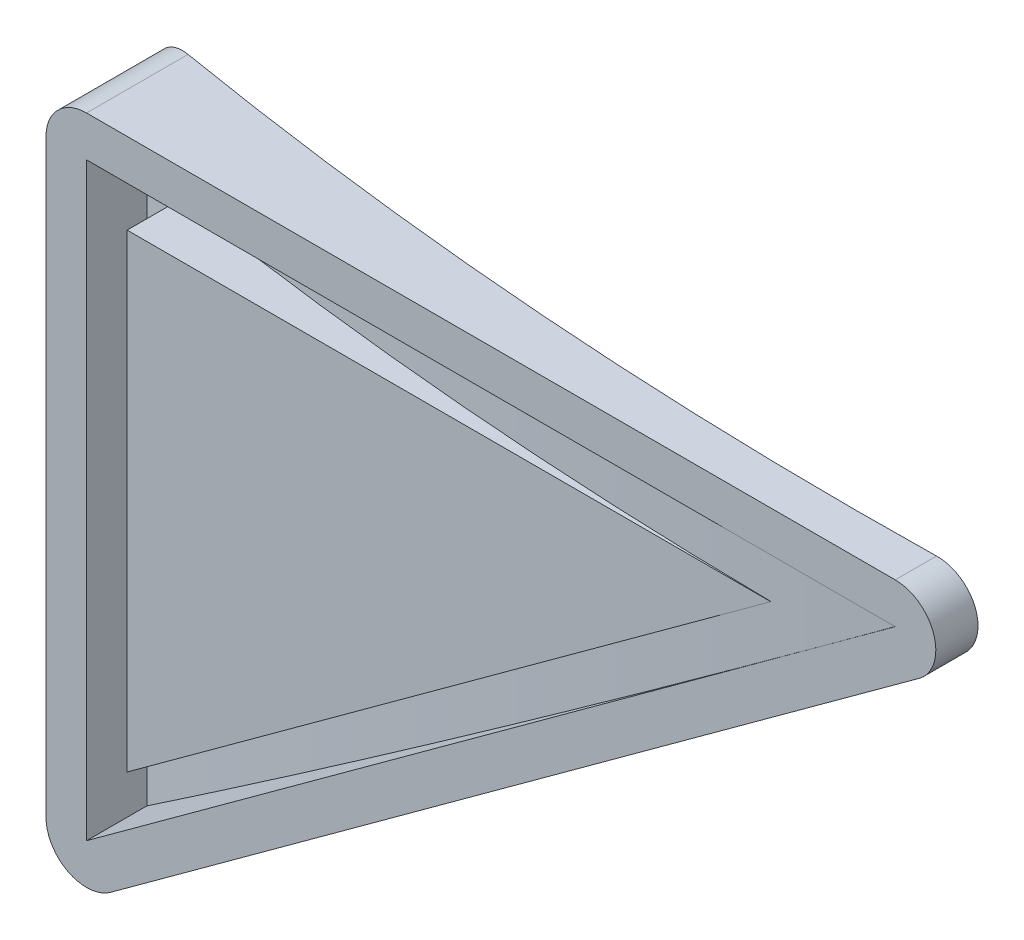
from build123d import *

# Parameters (mm, degrees)
BOSS_EXTRUDE1_DEPTH      = 175
FILLET1_R                = 10
CUT_EXTRUDE3_DEPTH       = 1129.731146152
CUT_EXTRUDE3_DEPTH_BACK  = 1129.731146152
SKETCH4_OUTSIDE_W        = 489.508
SKETCH4_OUTSIDE_H        = 264.508
FILLET4_R                = 10
BOSS_EXTRUDE2_REACH      = 261.692
BOSS_EXTRUDE2_END_RADIUS = 1097
BOSS_EXTRUDE3_REACH      = 261.692
BOSS_EXTRUDE3_END_RADIUS = 1097


with BuildPart() as part:
    # Sketch1 → Boss-Extrude1 (new body)
    with BuildSketch(Plane(origin=(0, 0, 0), x_dir=(1, 0, 0), z_dir=(0, 1, 0))):
        with BuildLine():
            Line((-200, -1068.442324134), (-200, -1078.614388927))
            ThreePointArc((-200, -1078.614388927), (0, -1097), (200, -1078.614388927))
            Line((200, -1078.614388927), (200, -1068.442324134))
            ThreePointArc((200, -1068.442324134), (0, -1087), (-200, -1068.442324134))
        make_face()
    extrude(amount=BOSS_EXTRUDE1_DEPTH)

    # Fillet1
    fillet1_edges = [part.edges().sort_by_distance(p)[0] for p in [
        (200, 175, 1073.52835653),
        (200, 0, 1073.52835653),
        (-200, 0, 1073.52835653),
    ]]
    fillet(fillet1_edges, radius=FILLET1_R)

    # Sketch4 outside → Cut-Extrude3 (cut, two sides: drawn at the far end of the back side and taken through both)
    with BuildSketch(Plane.XY.offset(-CUT_EXTRUDE3_DEPTH_BACK)):
        with Locations((0, 87.5)):
            Rectangle(SKETCH4_OUTSIDE_W, SKETCH4_OUTSIDE_H)
        Polygon((-190, 0), (50, 175), (-190, 175), align=None, mode=Mode.SUBTRACT)
    extrude(amount=CUT_EXTRUDE3_DEPTH + CUT_EXTRUDE3_DEPTH_BACK, mode=Mode.SUBTRACT)

    # Fillet4
    fillet4_edges = [part.edges().sort_by_distance(p)[0] for p in [
        (50, 175, 1090.854686691),
        (-190, 0, 1075.343303099),
        (-190, 175, 1075.343303099),
    ]]
    fillet(fillet4_edges, radius=FILLET4_R)

    # Boss-Extrude2: up to this cylinder (the profile starts outside it)
    boss_extrude2_end = Plane(origin=(0, 92.333894, 0), z_dir=(0, -1, 0)) * Cylinder(BOSS_EXTRUDE2_END_RADIUS, 2718.384, mode=Mode.PRIVATE)
    # Sketch5 → Boss-Extrude2 (add, up to the surface)
    with BuildSketch(Plane.XY.offset(1097), mode=Mode.PRIVATE) as boss_extrude2_sk1:
        with BuildLine():
            Line((-174.108278426, 11.587713648), (25.204468157, 156.919924698))
            ThreePointArc((25.204468157, 156.919924698), (28.820657842, 168.098325917), (19.312746583, 175))
            Line((19.312746583, 175), (-180, 175))
            ThreePointArc((-180, 175), (-187.071067812, 172.071067812), (-190, 165))
            Line((-190, 165), (-190, 19.66778895))
            ThreePointArc((-190, 19.66778895), (-184.53226126, 10.753833158), (-174.108278426, 11.587713648))
        make_face()
        Polygon((-180, 165), (-180, 19.66778895), (19.312746583, 165), align=None, mode=Mode.SUBTRACT)
    boss_extrude2_tool1 = extrude(boss_extrude2_sk1.sketch, amount=-BOSS_EXTRUDE2_REACH, mode=Mode.PRIVATE) - boss_extrude2_end
    add(boss_extrude2_tool1.solids().sort_by_distance((-187.253496, 92.333894, 1097))[0])
    add(boss_extrude2_tool1.solids().sort_by_distance((-187.253496, 92.333894, 1097))[1])

    # Boss-Extrude3: up to this cylinder (the profile starts outside it)
    boss_extrude3_end = Plane(origin=(0, 116.445193, 0), z_dir=(0, -1, 0)) * Cylinder(BOSS_EXTRUDE3_END_RADIUS, 2718.384, mode=Mode.PRIVATE)
    # Sketch6 → Boss-Extrude3 (add, up to the surface)
    with BuildSketch(Plane.XY.offset(1097), mode=Mode.PRIVATE) as boss_extrude3_sk1:
        Polygon((-11.374506835, 155), (-170, 155), (-170, 39.3355779), align=None)
    boss_extrude3_tool1 = extrude(boss_extrude3_sk1.sketch, amount=-BOSS_EXTRUDE3_REACH, mode=Mode.PRIVATE) - boss_extrude3_end
    add(boss_extrude3_tool1.solids().sort_by_distance((-117.124836, 116.445193, 1097))[0])


solid = part.part
